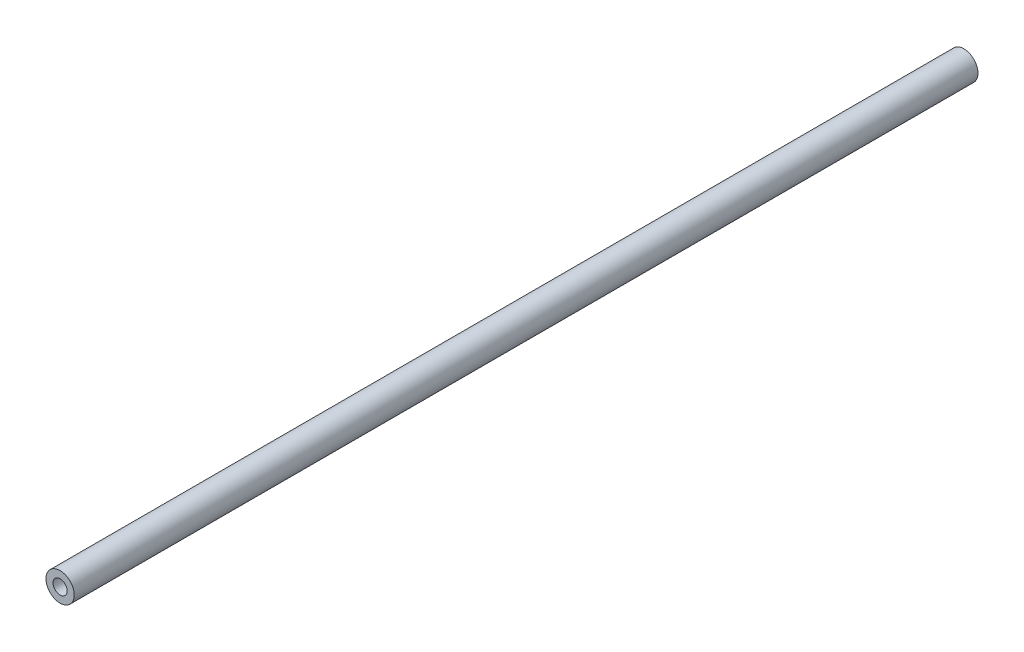
from build123d import *

# Parameters (mm, degrees)
SKETCH1_R           = 6.35
SKETCH1_R_2         = 3.175
BOSS_EXTRUDE1_DEPTH = 406.4


with BuildPart() as part:
    # Sketch1 → Boss-Extrude1 (new body)
    with BuildSketch(Plane.XY):
        Circle(SKETCH1_R)
        Circle(SKETCH1_R_2, mode=Mode.SUBTRACT)
    extrude(amount=BOSS_EXTRUDE1_DEPTH)


solid = part.part
